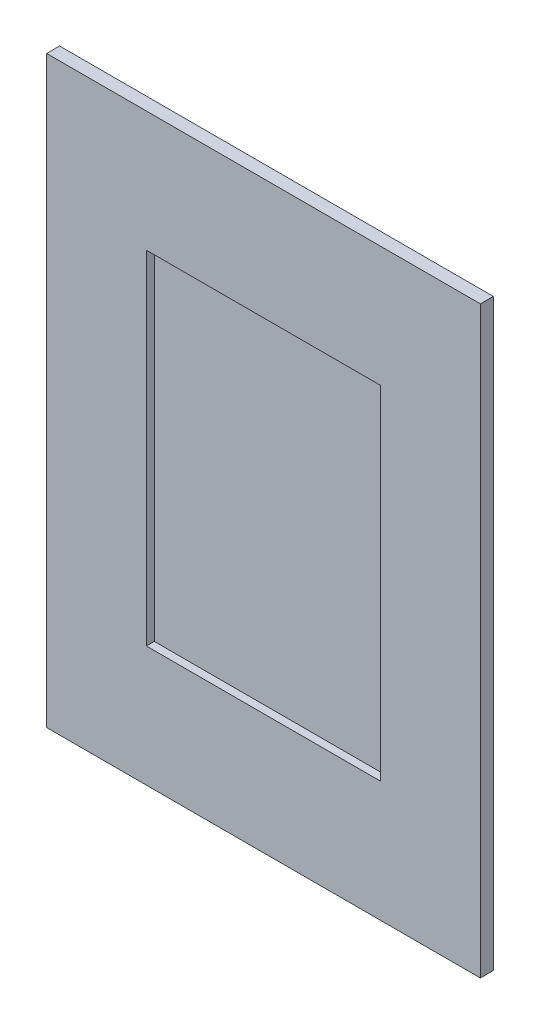
from build123d import *

# Parameters (mm, degrees)
SKETCH1_W           = 52
SKETCH1_H           = 70
BOSS_EXTRUDE1_DEPTH = 1.55
SKETCH2_W           = 28.1
SKETCH2_H           = 41.1
CUT_EXTRUDE1_DEPTH  = 0.95


with BuildPart() as part:
    # Sketch1 → Boss-Extrude1 (new body)
    with BuildSketch(Plane.XY):
        with Locations((-6.917431193, -10.137614679)):
            Rectangle(SKETCH1_W, SKETCH1_H)
    extrude(amount=BOSS_EXTRUDE1_DEPTH)

    # Sketch2 → Cut-Extrude1 (cut)
    with BuildSketch(Plane.XY.offset(1.55)):
        with Locations((-6.917431193, -10.137614679)):
            Rectangle(SKETCH2_W, SKETCH2_H)
    extrude(amount=-CUT_EXTRUDE1_DEPTH, mode=Mode.SUBTRACT)


solid = part.part
